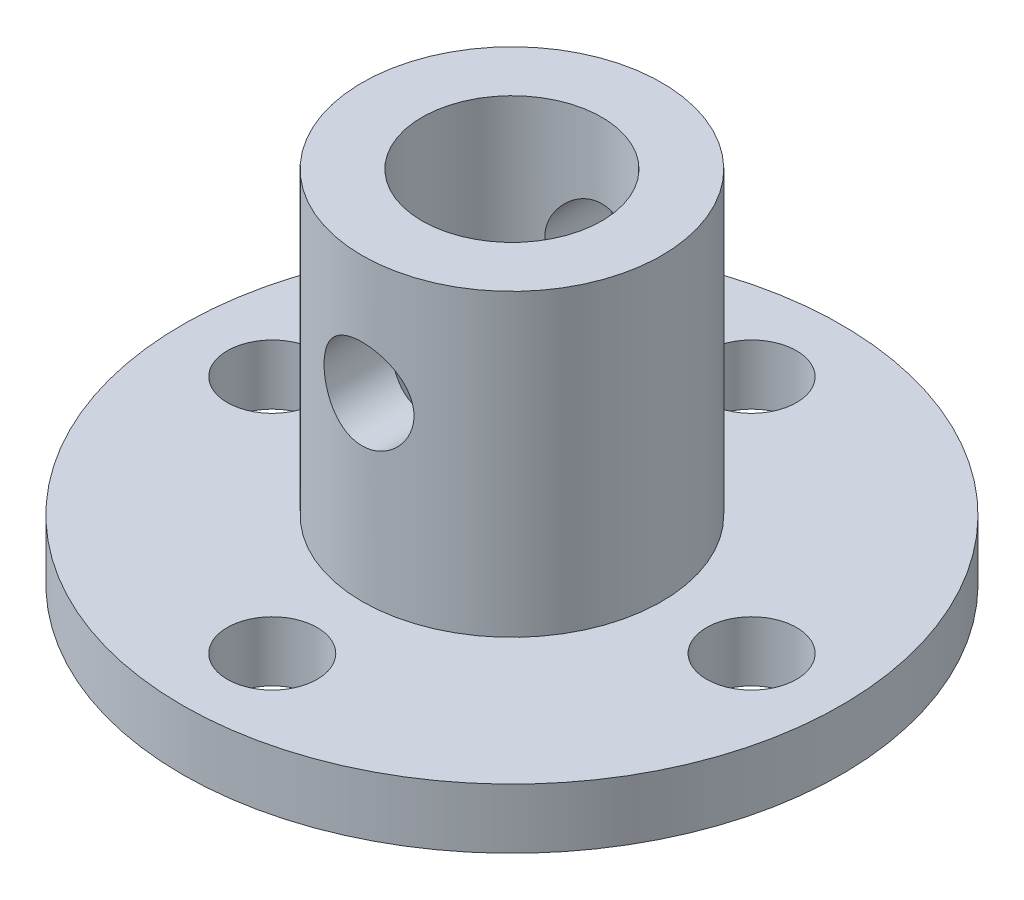
from build123d import *

# Parameters (mm, degrees)
SKETCH1_R               = 11
SKETCH1_R_2             = 1.5
SKETCH1_R_3             = 3
BOSS_EXTRUDE1_DEPTH     = 2
SKETCH3_R               = 5
SKETCH3_R_2             = 3
BOSS_EXTRUDE3_DEPTH     = 10
CUT_EXTRUDE1_DEPTH      = 20.646882704
CUT_EXTRUDE1_DEPTH_BACK = 20.646882704
SKETCH4_R               = 1.5


with BuildPart() as part:
    # Sketch1 → Boss-Extrude1 (new body)
    with BuildSketch(Plane(origin=(0, 0, 0), x_dir=(1, 0, 0), z_dir=(0, 1, 0))):
        with Locations(Location((0, 0, 0), (0, 0, 270))):
            Circle(SKETCH1_R)
        with Locations(Location((8, 0, 0), (0, 0, 270))):
            Circle(SKETCH1_R_2, mode=Mode.SUBTRACT)
        with Locations(Location((0, -8, 0), (0, 0, 270))):
            Circle(SKETCH1_R_2, mode=Mode.SUBTRACT)
        with Locations(Location((-8, 0, 0), (0, 0, 270))):
            Circle(SKETCH1_R_2, mode=Mode.SUBTRACT)
        with Locations(Location((0, 8, 0), (0, 0, 270))):
            Circle(SKETCH1_R_2, mode=Mode.SUBTRACT)
        with Locations(Location((0, 0, 0), (0, 0, 270))):
            Circle(SKETCH1_R_3, mode=Mode.SUBTRACT)
    extrude(amount=BOSS_EXTRUDE1_DEPTH)

    # Sketch3 → Boss-Extrude3 (add)
    with BuildSketch(Plane(origin=(0, 2, 0), x_dir=(1, 0, 0), z_dir=(0, 1, 0))):
        with Locations(Location((0, 0, 0), (0, 0, 270))):
            Circle(SKETCH3_R)
        with Locations(Location((0, 0, 0), (0, 0, 270))):
            Circle(SKETCH3_R_2, mode=Mode.SUBTRACT)
    extrude(amount=BOSS_EXTRUDE3_DEPTH)

    # Sketch4 → Cut-Extrude1 (cut, two sides: drawn at the far end of the back side and taken through both)
    with BuildSketch(Plane.XY.offset(-CUT_EXTRUDE1_DEPTH_BACK)):
        with Locations((0, 8)):
            Circle(SKETCH4_R)
    extrude(amount=CUT_EXTRUDE1_DEPTH + CUT_EXTRUDE1_DEPTH_BACK, mode=Mode.SUBTRACT)


solid = part.part
